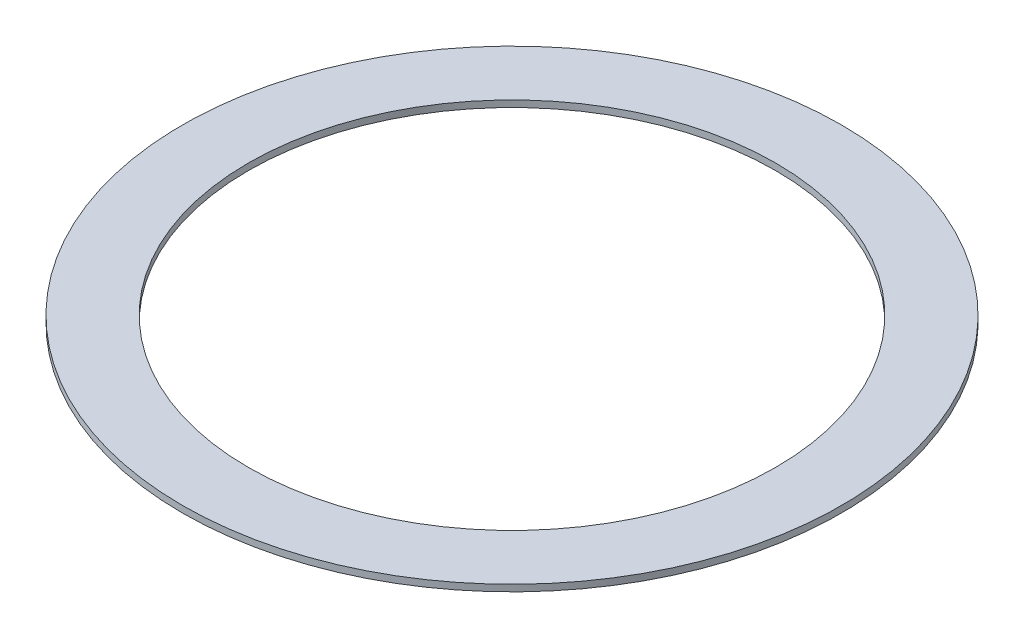
from build123d import *

# Parameters (mm, degrees)
SKETCH_1_R      = 100
SKETCH_1_R_2    = 80
EXTRUDE_1_DEPTH = 2


with BuildPart() as part:
    # 草图1 → 凸台-拉伸1 (new body)
    with BuildSketch(Plane(origin=(0, 0, 0), x_dir=(1, 0, 0), z_dir=(0, 1, 0))):
        with Locations(Location((0, 0, 0), (0, 0, 270))):
            Circle(SKETCH_1_R)
        with Locations(Location((0, 0, 0), (0, 0, 270))):
            Circle(SKETCH_1_R_2, mode=Mode.SUBTRACT)
    extrude(amount=EXTRUDE_1_DEPTH)


solid = part.part
